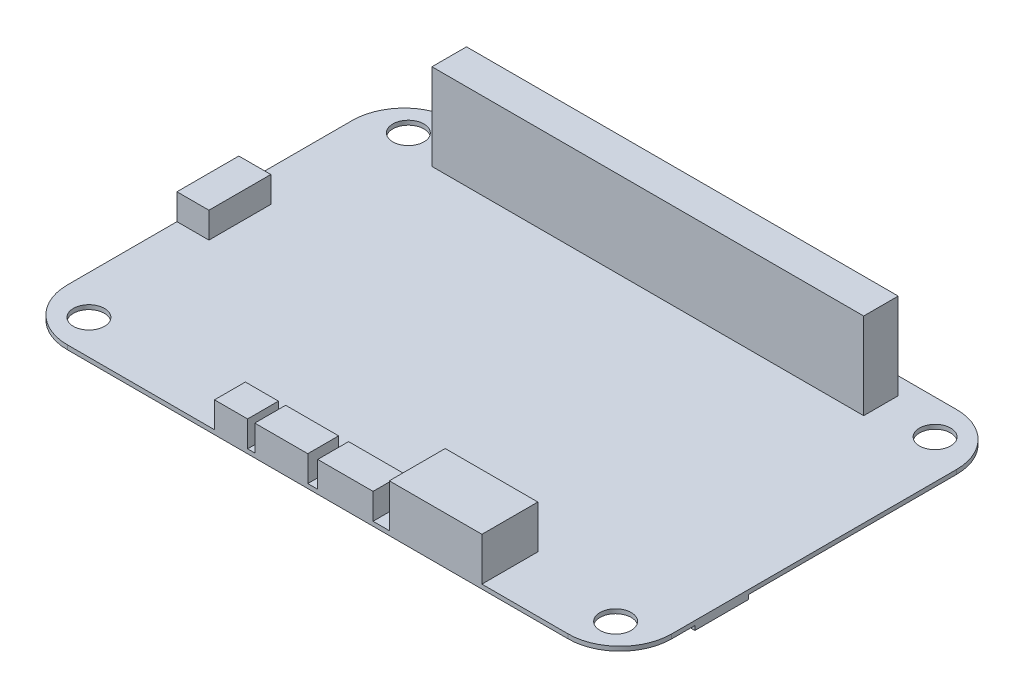
from build123d import *

# Parameters (mm, degrees)
SKETCH_1_W          = 70
SKETCH_1_H          = 45
EXTRUDE_1_DEPTH     = 0.5
FILLET_1_R          = 6
SKETCH_3_R          = 1.8
CUT_EXTRUDE_1_DEPTH = 1
SKETCH_4_W          = 50
SKETCH_4_H          = 4
EXTRUDE_2_DEPTH     = 10
SKETCH_5_W          = 9.523878632
SKETCH_5_H          = 2.249484867
SKETCH_5_W_2        = 4.565570684
SKETCH_5_H_2        = 4.556816288
SKETCH_5_W_3        = 17.967729791
SKETCH_5_W_4        = 12.616684579
SKETCH_5_W_5        = 12.076670843
SKETCH_5_H_3        = 12.420315948
SKETCH_5_W_6        = 3.409196393
SKETCH_5_H_4        = 6.234704053
EXTRUDE_3_DEPTH     = 0.5
SKETCH_6_W          = 10.728619563
SKETCH_6_H          = 6.475095536
EXTRUDE_4_DEPTH     = 5
SKETCH_7_W          = 6.406526606
SKETCH_7_H          = 3.574973131
SKETCH_7_W_2        = 6.136519737
SKETCH_7_W_3        = 3.829188316
SKETCH_7_W_4        = 3.70374934
SKETCH_7_H_2        = 7.167455053
EXTRUDE_5_DEPTH     = 3


with BuildPart() as part:
    # 草图1 → 凸台-拉伸1 (new body)
    with BuildSketch(Plane(origin=(0, 0, 0), x_dir=(1, 0, 0), z_dir=(0, 1, 0))):
        Rectangle(SKETCH_1_W, SKETCH_1_H)
    extrude(amount=EXTRUDE_1_DEPTH)

    # 圆角1
    fillet_1_edges = [part.edges().sort_by_distance(p)[0] for p in [
        (-35, 0.25, -22.5),
        (35, 0.25, -22.5),
        (35, 0.25, 22.5),
        (-35, 0.25, 22.5),
    ]]
    fillet(fillet_1_edges, radius=FILLET_1_R)

    # 草图3 → 切除-拉伸1 (cut)
    with BuildSketch(Plane(origin=(0, 0.5, 0), x_dir=(1, 0, 0), z_dir=(0, 1, 0))):
        with Locations(Location((30.5, 18.5, 0), (0, 0, 270))):
            Circle(SKETCH_3_R)
        with Locations(Location((30.5, -18.5, 0), (0, 0, 270))):
            Circle(SKETCH_3_R)
        with Locations(Location((-30.5, -18.5, 0), (0, 0, 270))):
            Circle(SKETCH_3_R)
        with Locations(Location((-30.5, 18.5, 0), (0, 0, 270))):
            Circle(SKETCH_3_R)
    extrude(amount=-CUT_EXTRUDE_1_DEPTH, mode=Mode.SUBTRACT)

    # 草图4 → 凸台-拉伸2 (add)
    with BuildSketch(Plane(origin=(0, 0.5, 0), x_dir=(1, 0, 0), z_dir=(0, 1, 0))):
        with Locations((-0.770536001, 18.5)):
            Rectangle(SKETCH_4_W, SKETCH_4_H)
    extrude(amount=EXTRUDE_2_DEPTH)

    # 草图5 → 凸台-拉伸3 (add)
    with BuildSketch(Plane.XZ):
        with Locations((-20.495975922, -21.375257567)):
            Rectangle(SKETCH_5_W, SKETCH_5_H)
        with Locations((-10.162076685, -20.221591856)):
            Rectangle(SKETCH_5_W_2, SKETCH_5_H_2)
        with Locations((4.491932447, -20.221591856)):
            Rectangle(SKETCH_5_W_3, SKETCH_5_H_2)
        with Locations((21.846010265, -20.221591856)):
            Rectangle(SKETCH_5_W_4, SKETCH_5_H_2)
        with Locations((-22.361477923, -6.529257)):
            Rectangle(SKETCH_5_W_5, SKETCH_5_H_3)
        with Locations((33.295401803, 10.702090421)):
            Rectangle(SKETCH_5_W_6, SKETCH_5_H_4)
    extrude(amount=EXTRUDE_3_DEPTH)

    # 草图6 → 凸台-拉伸4 (add)
    with BuildSketch(Plane(origin=(0, 0.5, 0), x_dir=(1, 0, 0), z_dir=(0, 1, 0))):
        with Locations((13.653186787, -19.262452232)):
            Rectangle(SKETCH_6_W, SKETCH_6_H)
    extrude(amount=EXTRUDE_4_DEPTH)

    # 草图7 → 凸台-拉伸5 (add)
    with BuildSketch(Plane(origin=(0, 0.5, 0), x_dir=(1, 0, 0), z_dir=(0, 1, 0))):
        with Locations((3.203263303, -20.712513434)):
            Rectangle(SKETCH_7_W, SKETCH_7_H)
        with Locations((-4.22192558, -20.712513434)):
            Rectangle(SKETCH_7_W_2, SKETCH_7_H)
        with Locations((-10.03934629, -20.712513434)):
            Rectangle(SKETCH_7_W_3, SKETCH_7_H)
        with Locations((-33.14812533, -0.22091471)):
            Rectangle(SKETCH_7_W_4, SKETCH_7_H_2)
    extrude(amount=EXTRUDE_5_DEPTH)


solid = part.part
